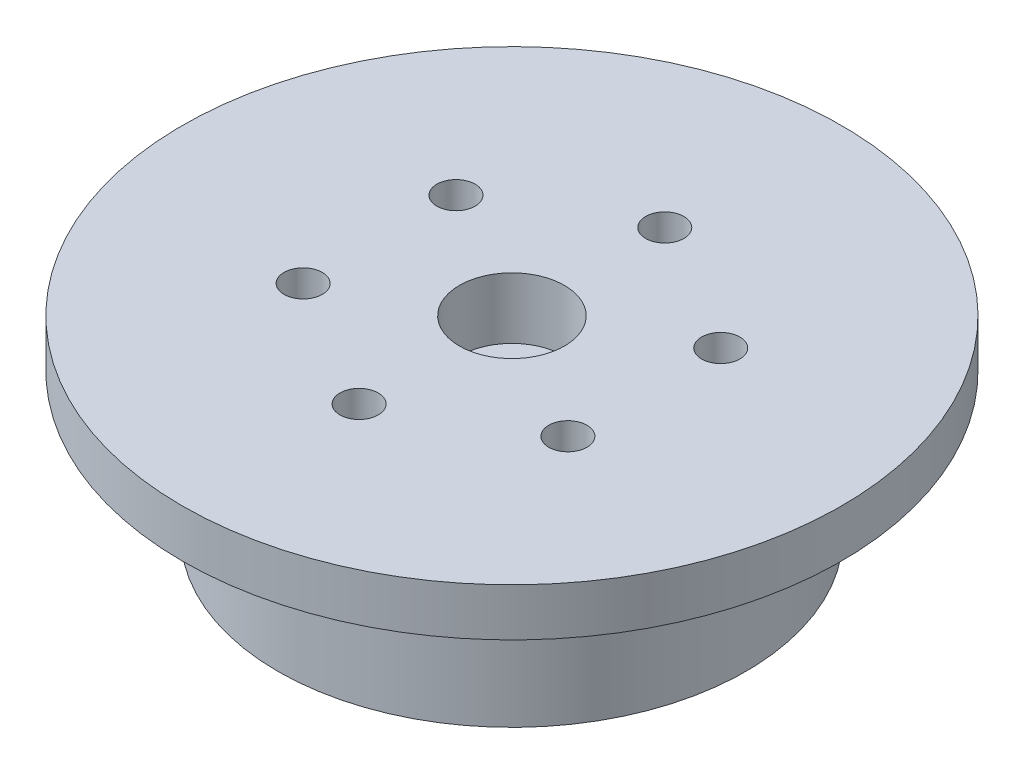
from build123d import *

# Parameters (mm, degrees)
CROQUIS1_R                                          = 34.5
SALIENTE_EXTRUIR1_DEPTH                             = 5
CROQUIS2_R                                          = 24.5
SALIENTE_EXTRUIR2_DEPTH                             = 15
CROQUIS3_R                                          = 6.85
SALIENTE_EXTRUIR3_DEPTH                             = 30
CROQUIS4_R                                          = 2
CORTAR_EXTRUIR1_DEPTH                               = 10
MATRIZC1_COUNT                                      = 6
CORTAR_EXTRUIR2_START                               = -30
CORTAR_EXTRUIR2_DEPTH                               = 30
CUT_EXTRUDE1_START                                  = -40
CUT_EXTRUDE1_DEPTH                                  = 40
CBORE_FOR_M6_HEX_SOCKET_HEAD_CAP_SCREW1_D           = 6.6
CBORE_FOR_M6_HEX_SOCKET_HEAD_CAP_SCREW1_CBORE_D     = 11
CBORE_FOR_M6_HEX_SOCKET_HEAD_CAP_SCREW1_CBORE_DEPTH = 6.4


with BuildPart() as part:
    # Croquis1 → Saliente-Extruir1 (new body)
    with BuildSketch(Plane(origin=(0, 0, 0), x_dir=(1, 0, 0), z_dir=(0, 1, 0))):
        with Locations(Location((0, 0, 0), (0, 0, 270))):
            Circle(CROQUIS1_R)
    extrude(amount=SALIENTE_EXTRUIR1_DEPTH)

    # Croquis2 → Saliente-Extruir2 (add)
    with BuildSketch(Plane.XZ):
        with Locations(Location((0, 0, 0), (0, 0, 270))):
            Circle(CROQUIS2_R)
    extrude(amount=SALIENTE_EXTRUIR2_DEPTH)

    # Croquis3 → Saliente-Extruir3 (add)
    with BuildSketch(Plane.XZ.offset(15)):
        with Locations(Location((0, 0, 0), (0, 0, 270))):
            Circle(CROQUIS3_R)
    extrude(amount=SALIENTE_EXTRUIR3_DEPTH)

    # Croquis4 → Cortar-Extruir1 (cut)
    with BuildSketch(Plane(origin=(0, 5, 0), x_dir=(1, 0, 0), z_dir=(0, 1, 0))):
        with Locations(Location((0, 16, 0), (0, 0, 270))):
            Circle(CROQUIS4_R)
    cortar_extruir1 = extrude(amount=-CORTAR_EXTRUIR1_DEPTH, mode=Mode.SUBTRACT)

    # MatrizC1: Cortar-Extruir1 ×6 about axis
    matrizc1_axis = Axis((0, 0, 0), (0, 1, 0))
    for i in range(1, MATRIZC1_COUNT):
        add(cortar_extruir1.rotate(matrizc1_axis, i * 360 / MATRIZC1_COUNT), mode=Mode.SUBTRACT)

    # Croquis7 → Cortar-Extruir2 (cut)
    with BuildSketch(Plane.XZ.offset(45).offset(CORTAR_EXTRUIR2_START)):
        with BuildLine():
            Line((-6.37749951, 2.5), (-3.47749951, 2.5))
            Line((-3.47749951, 2.5), (-3.47749951, -2.5))
            Line((-3.47749951, -2.5), (-6.37749951, -2.5))
            ThreePointArc((-6.37749951, -2.5), (-6.85, 0), (-6.37749951, 2.5))
        make_face()
    extrude(amount=CORTAR_EXTRUIR2_DEPTH, mode=Mode.SUBTRACT)

    # Sketch1 → Cut-Extrude1 (cut)
    with BuildSketch(Plane.XZ.offset(45).offset(CUT_EXTRUDE1_START)):
        with BuildLine():
            Line((-6.37749951, -2.5), (-9.35, -2.5))
            Line((-9.35, -2.5), (-9.35, 2.5))
            Line((-9.35, 2.5), (-6.37749951, 2.5))
            ThreePointArc((-6.37749951, 2.5), (6.85, 0), (-6.37749951, -2.5))
        make_face()
    extrude(amount=CUT_EXTRUDE1_DEPTH, mode=Mode.SUBTRACT)

    # CBORE for M6 Hex Socket Head Cap Screw1 (through all)
    with Locations(Plane(origin=(0, 5, 0), x_dir=(1, 0, 0), z_dir=(0, 1, 0))):
        with Locations((0, 0)):
            CounterBoreHole(CBORE_FOR_M6_HEX_SOCKET_HEAD_CAP_SCREW1_D / 2, CBORE_FOR_M6_HEX_SOCKET_HEAD_CAP_SCREW1_CBORE_D / 2, CBORE_FOR_M6_HEX_SOCKET_HEAD_CAP_SCREW1_CBORE_DEPTH)


solid = part.part
